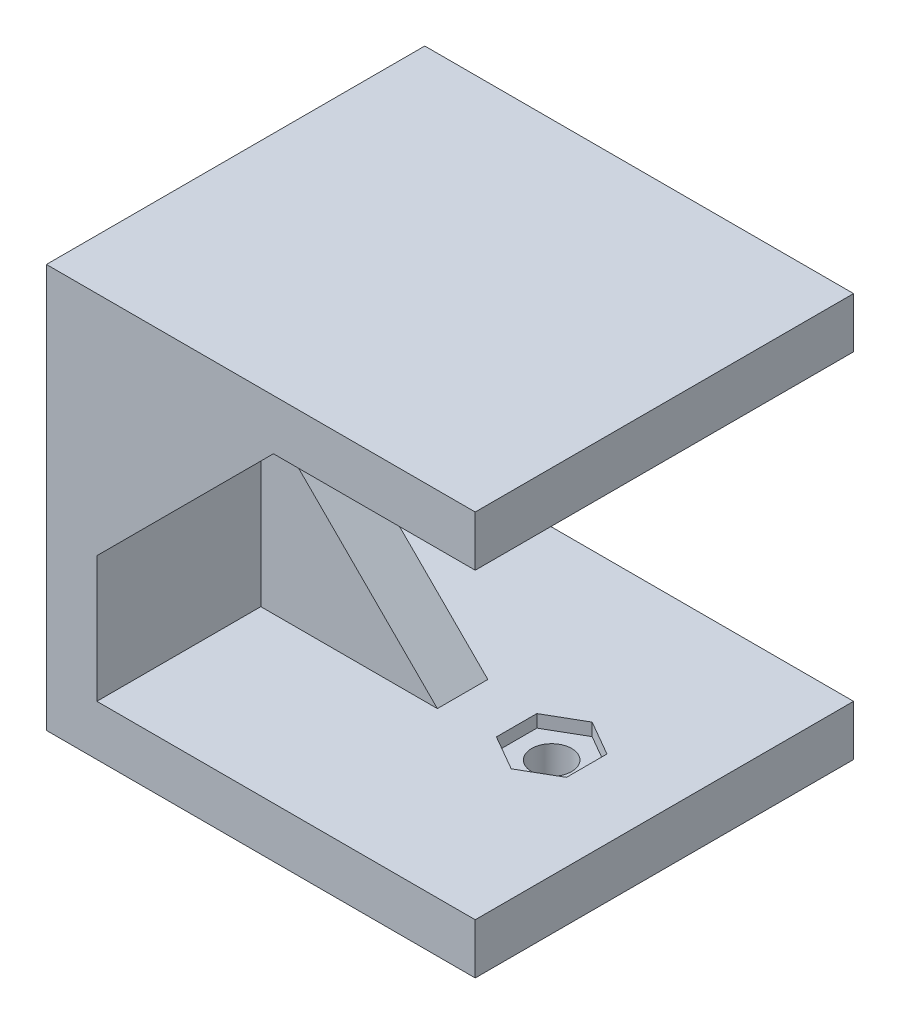
from build123d import *

# Parameters (mm, degrees)
SKETCH1_W                = 68
SKETCH1_H                = 60
BOSS_EXTRUDE1_DEPTH      = 8
SKETCH4_W                = 8
SKETCH4_H                = 60
BOSS_EXTRUDE2_DEPTH      = 56
SKETCH5_R                = 3.175
CUT_EXTRUDE1_DEPTH       = 8
SKETCH6_W                = 60
SKETCH6_H                = 8
BOSS_EXTRUDE3_DEPTH      = 60
BOSS_EXTRUDE4_DEPTH      = 8
BOSS_EXTRUDE5_DEPTH      = 4
BOSS_EXTRUDE5_DEPTH_BACK = 4
CUT_EXTRUDE2_DEPTH       = 2


with BuildPart() as part:
    # Sketch1 → Boss-Extrude1 (new body)
    with BuildSketch(Plane(origin=(0, 0, 0), x_dir=(1, 0, 0), z_dir=(0, 1, 0))):
        with Locations((34, 30)):
            Rectangle(SKETCH1_W, SKETCH1_H)
    extrude(amount=BOSS_EXTRUDE1_DEPTH)

    # Sketch4 → Boss-Extrude2 (add)
    with BuildSketch(Plane(origin=(0, 8, 0), x_dir=(1, 0, 0), z_dir=(0, 1, 0))):
        with Locations((4, 30)):
            Rectangle(SKETCH4_W, SKETCH4_H)
    extrude(amount=BOSS_EXTRUDE2_DEPTH)

    # Sketch5 → Cut-Extrude1 (cut)
    with BuildSketch(Plane(origin=(0, 8, 0), x_dir=(1, 0, 0), z_dir=(0, 1, 0))):
        with Locations(Location((50.125, 30, 0), (0, 0, 270))):
            Circle(SKETCH5_R)
    extrude(amount=-CUT_EXTRUDE1_DEPTH, mode=Mode.SUBTRACT)

    # Sketch6 → Boss-Extrude3 (add)
    with BuildSketch(Plane(origin=(8, 0, 0), x_dir=(0, 0, -1), z_dir=(1, 0, 0))):
        with Locations((30, 60)):
            Rectangle(SKETCH6_W, SKETCH6_H)
    extrude(amount=BOSS_EXTRUDE3_DEPTH)

    # Sketch7 → Boss-Extrude4 (add)
    with BuildSketch(Plane.XY):
        Polygon((8, 56), (8, 28), (36, 56), align=None)
    boss_extrude4 = extrude(amount=-BOSS_EXTRUDE4_DEPTH)

    # Mirror1: Boss-Extrude4 across plane
    add(boss_extrude4.mirror(Plane.XY.offset(-30)))

    # Sketch8 → Boss-Extrude5 (add, two sides: drawn at the far end of the back side and taken through both)
    with BuildSketch(Plane.XY.offset(-30).offset(-BOSS_EXTRUDE5_DEPTH_BACK)):
        Polygon((8, 36), (8, 8), (36, 8), align=None)
    extrude(amount=BOSS_EXTRUDE5_DEPTH + BOSS_EXTRUDE5_DEPTH_BACK)

    # Sketch9 → Cut-Extrude2 (cut)
    with BuildSketch(Plane(origin=(0, 8, 0), x_dir=(1, 0, 0), z_dir=(0, 1, 0))):
        Polygon((50.125, 36.415804866), (44.56875, 33.207902433), (44.56875, 26.792097567), (50.125, 23.584195134), (55.68125, 26.792097567), (55.68125, 33.207902433), align=None)
    extrude(amount=-CUT_EXTRUDE2_DEPTH, mode=Mode.SUBTRACT)


solid = part.part
